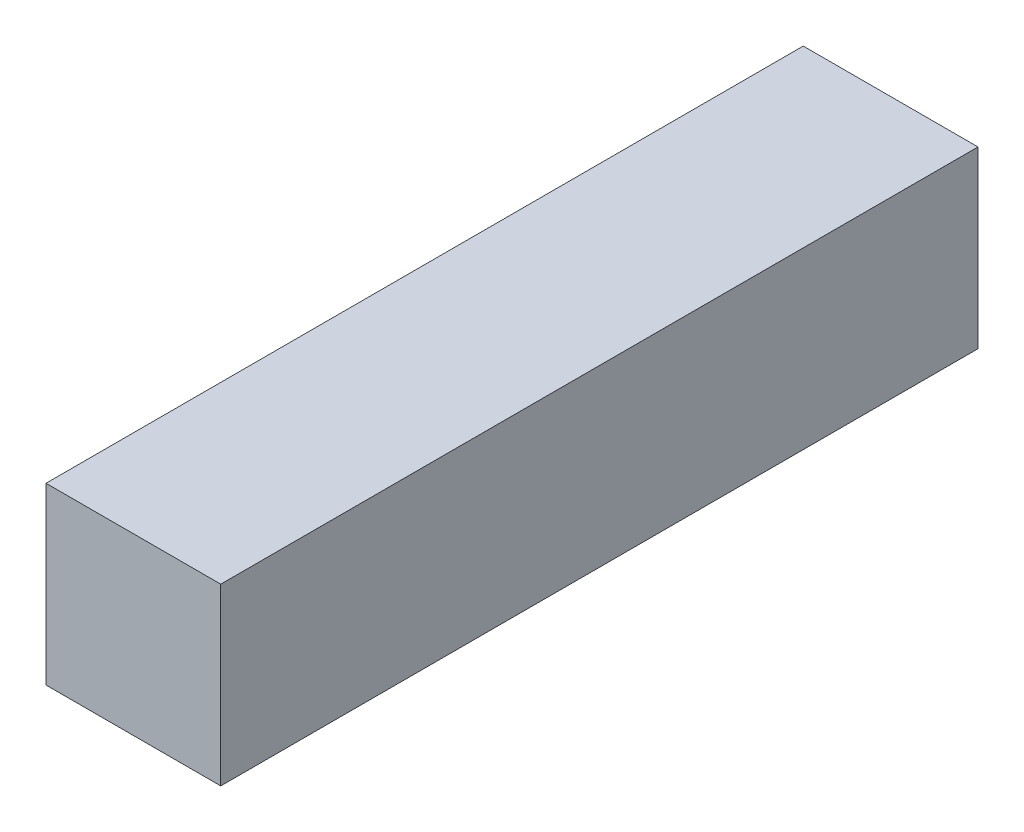
from build123d import *

# Parameters (mm, degrees)
ESQUISSE1_W        = 30
ESQUISSE1_H        = 30
BOSS_EXTRU_1_DEPTH = 130


with BuildPart() as part:
    # Esquisse1 → Boss.-Extru.1 (new body)
    with BuildSketch(Plane.XY):
        with Locations((-59.074163449, 15.595238095)):
            Rectangle(ESQUISSE1_W, ESQUISSE1_H)
    extrude(amount=BOSS_EXTRU_1_DEPTH)


solid = part.part
